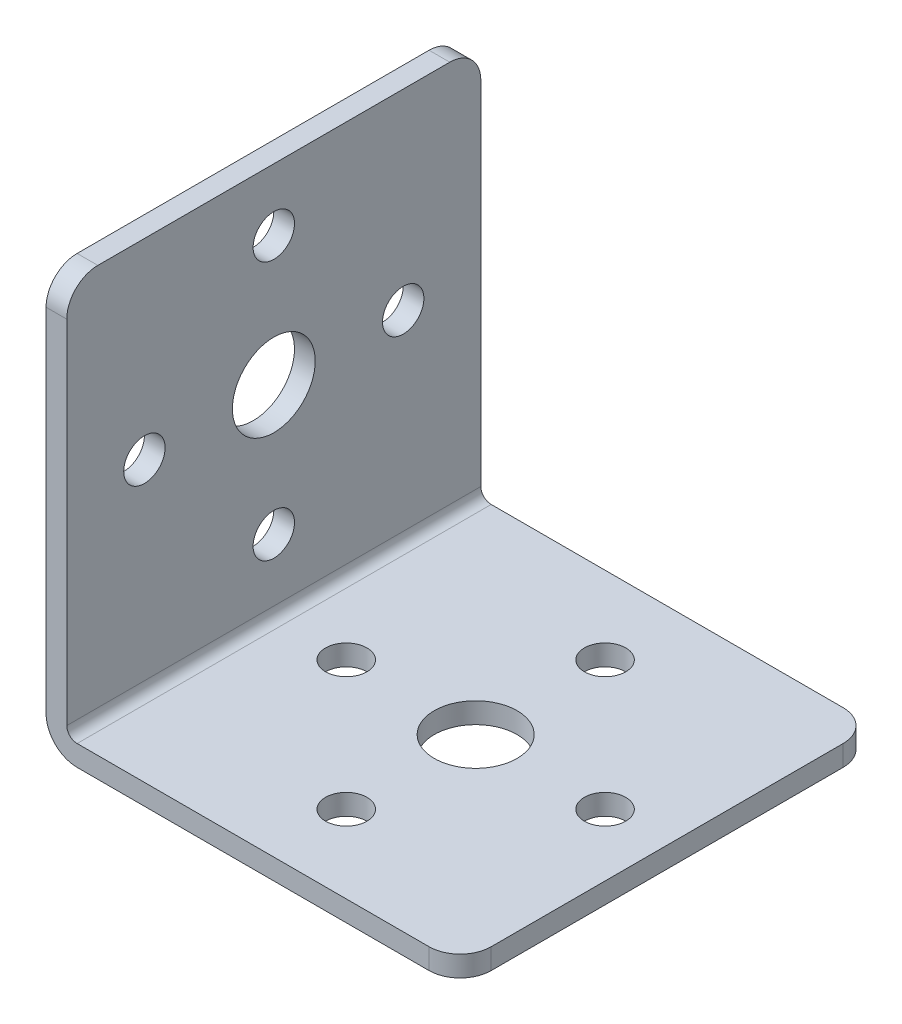
from build123d import *

# Parameters (mm, degrees)
EXTRUDE_1_DEPTH     = 40
SKETCH_2_R          = 2
SKETCH_2_R_2        = 4
CUT_EXTRUDE_1_DEPTH = 40
SKETCH_3_R          = 2
SKETCH_3_R_2        = 4
CUT_EXTRUDE_2_DEPTH = 40
FILLET_1_R          = 3


with BuildPart() as part:
    # Эскиз1 → Бобышка-Вытянуть1 (new body)
    with BuildSketch(Plane.XY):
        with BuildLine():
            Line((-3, 37), (-3, 0))
            ThreePointArc((-3, 0), (-2.121320344, -2.121320344), (0, -3))
            Line((0, -3), (37, -3))
            Line((37, -3), (37, -1))
            Line((37, -1), (0, -1))
            ThreePointArc((0, -1), (-0.707106781, -0.707106781), (-1, 0))
            Line((-1, 0), (-1, 37))
            Line((-1, 37), (-3, 37))
        make_face()
    extrude(amount=EXTRUDE_1_DEPTH)

    # Эскиз2 → Вырез-Вытянуть1 (cut)
    with BuildSketch(Plane.ZY.offset(3)):
        with Locations(Location((7.5, 18.5, 0), (0, 0, 270))):
            Circle(SKETCH_2_R)
        with Locations(Location((20, 31, 0), (0, 0, 270))):
            Circle(SKETCH_2_R)
        with Locations(Location((20, 18.5, 0), (0, 0, 270))):
            Circle(SKETCH_2_R_2)
        with Locations(Location((32.5, 18.5, 0), (0, 0, 270))):
            Circle(SKETCH_2_R)
        with Locations(Location((20, 6, 0), (0, 0, 270))):
            Circle(SKETCH_2_R)
    extrude(amount=-CUT_EXTRUDE_1_DEPTH, mode=Mode.SUBTRACT)

    # Эскиз3 → Вырез-Вытянуть2 (cut)
    with BuildSketch(Plane.XZ.offset(3)):
        with Locations((18.5, 7.5)):
            Circle(SKETCH_3_R)
        with Locations((6, 20)):
            Circle(SKETCH_3_R)
        with Locations((18.5, 32.5)):
            Circle(SKETCH_3_R)
        with Locations((31, 20)):
            Circle(SKETCH_3_R)
        with Locations((18.5, 20)):
            Circle(SKETCH_3_R_2)
    extrude(amount=-CUT_EXTRUDE_2_DEPTH, mode=Mode.SUBTRACT)

    # Скругление1
    fillet_1_edges = [part.edges().sort_by_distance(p)[0] for p in [
        (-2, 37, 0),
        (37, -2, 40),
        (-2, 37, 40),
        (37, -2, 0),
    ]]
    fillet(fillet_1_edges, radius=FILLET_1_R)


solid = part.part
